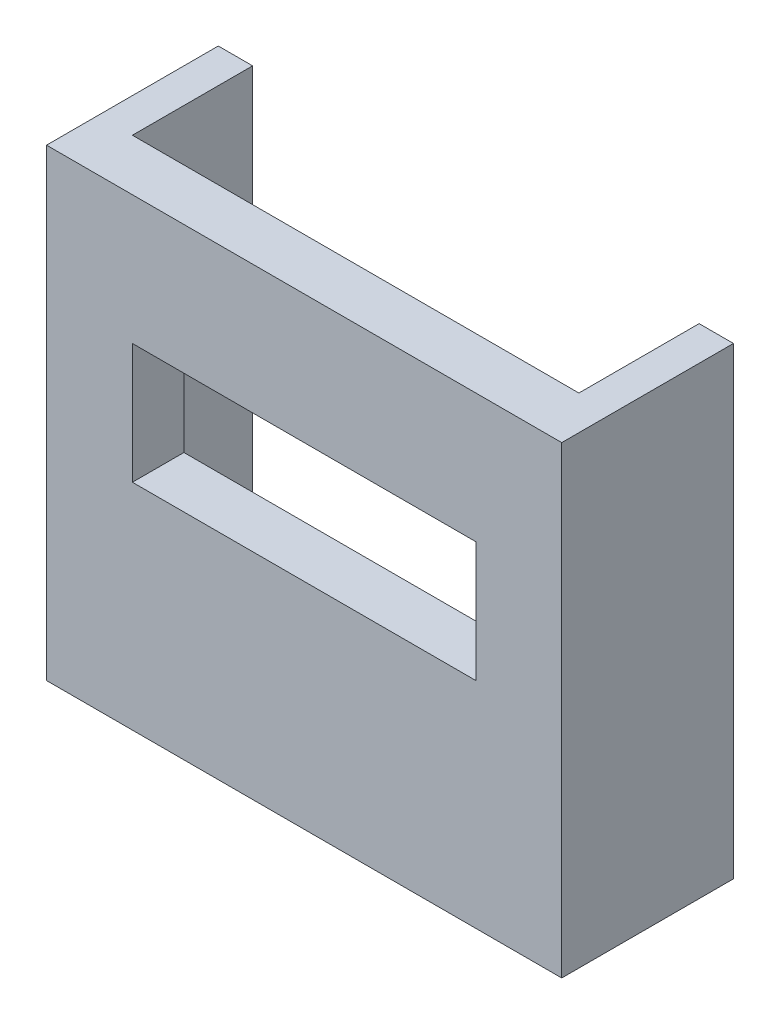
from build123d import *

# Parameters (mm, degrees)
CROQUIS1_W              = 30
CROQUIS1_H              = 10
SALIENTE_EXTRUIR1_DEPTH = 30
CORTAR_EXTRUIR1_REACH   = 45.589
CROQUIS2_W              = 20
CROQUIS2_H              = 7
CROQUIS4_W              = 26
CROQUIS4_H              = 24
CORTAR_EXTRUIR3_DEPTH   = 7
CORTAR_EXTRUIR4_REACH   = 43.581
CROQUIS5_R              = 2.5
CROQUIS6_W              = 30
CROQUIS6_H              = 10
CORTAR_EXTRUIR5_DEPTH   = 3


with BuildPart() as part:
    # Croquis1 → Saliente-Extruir1 (new body)
    with BuildSketch(Plane(origin=(0, 0, 0), x_dir=(1, 0, 0), z_dir=(0, 1, 0))):
        with Locations((-15, -5)):
            Rectangle(CROQUIS1_W, CROQUIS1_H)
    extrude(amount=SALIENTE_EXTRUIR1_DEPTH)

    # Croquis2 → Cortar-Extruir1 (cut, up to next)
    with BuildSketch(Plane.XY.offset(10), mode=Mode.PRIVATE) as cortar_extruir1_sk1:
        with Locations((-15, 16)):
            Rectangle(CROQUIS2_W, CROQUIS2_H)
    cortar_extruir1_tool1 = extrude(cortar_extruir1_sk1.sketch, amount=-CORTAR_EXTRUIR1_REACH, mode=Mode.PRIVATE) & part.part
    add(cortar_extruir1_tool1.solids().sort_by_distance((-15, 16, 10))[0], mode=Mode.SUBTRACT)

    # Croquis4 → Cortar-Extruir3 (cut)
    with BuildSketch(Plane(origin=(0, 0, 0), x_dir=(-1, 0, 0), z_dir=(0, 0, -1))):
        with Locations((15, 15)):
            Rectangle(CROQUIS4_W, CROQUIS4_H)
    extrude(amount=-CORTAR_EXTRUIR3_DEPTH, mode=Mode.SUBTRACT)

    # Croquis5 → Cortar-Extruir4 (cut, up to next)
    with BuildSketch(Plane(origin=(0, 3, 0), x_dir=(1, 0, 0), z_dir=(0, 1, 0)), mode=Mode.PRIVATE) as cortar_extruir4_sk1:
        with Locations((-15, 0)):
            Circle(CROQUIS5_R)
    cortar_extruir4_tool1 = extrude(cortar_extruir4_sk1.sketch, amount=-CORTAR_EXTRUIR4_REACH, mode=Mode.PRIVATE) & part.part
    add(cortar_extruir4_tool1.solids().sort_by_distance((-15, 3, 0))[0], mode=Mode.SUBTRACT)

    # Croquis6 → Cortar-Extruir5 (cut)
    with BuildSketch(Plane(origin=(0, 30, 0), x_dir=(1, 0, 0), z_dir=(0, 1, 0))):
        with Locations((-15, -5)):
            Rectangle(CROQUIS6_W, CROQUIS6_H)
    extrude(amount=-CORTAR_EXTRUIR5_DEPTH, mode=Mode.SUBTRACT)


solid = part.part
